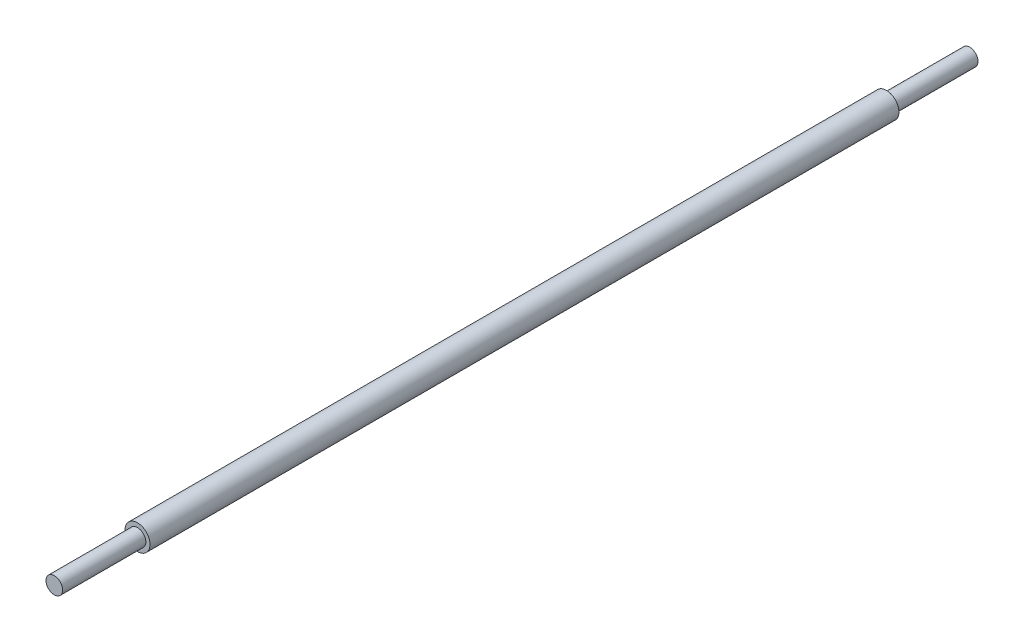
from build123d import *

# Parameters (mm, degrees)
CROQUIS1_R              = 6
SALIENTE_EXTRUIR1_DEPTH = 400
CROQUIS2_OUTSIDE_W      = 94.072
CROQUIS2_OUTSIDE_H      = 94.072
CROQUIS2_OUTSIDE_R      = 4
CORTAR_EXTRUIR3_DEPTH   = 40
CROQUIS3_R              = 4
SALIENTE_EXTRUIR2_DEPTH = 40


with BuildPart() as part:
    # Croquis1 → Saliente-Extruir1 (new body)
    with BuildSketch(Plane.XY):
        Circle(CROQUIS1_R)
    extrude(amount=SALIENTE_EXTRUIR1_DEPTH)

    # Croquis2 outside → Cortar-Extruir3 (cut)
    with BuildSketch(Plane.XY.offset(400)):
        Rectangle(CROQUIS2_OUTSIDE_W, CROQUIS2_OUTSIDE_H)
        Circle(CROQUIS2_OUTSIDE_R, mode=Mode.SUBTRACT)
    extrude(amount=-CORTAR_EXTRUIR3_DEPTH, mode=Mode.SUBTRACT)

    # Croquis3 → Saliente-Extruir2 (add)
    with BuildSketch(Plane(origin=(0, 0, 0), x_dir=(-1, 0, 0), z_dir=(0, 0, -1))):
        with Locations(Location((0, 0, 0), (0, 0, 180))):
            Circle(CROQUIS3_R)
    extrude(amount=SALIENTE_EXTRUIR2_DEPTH)


solid = part.part
